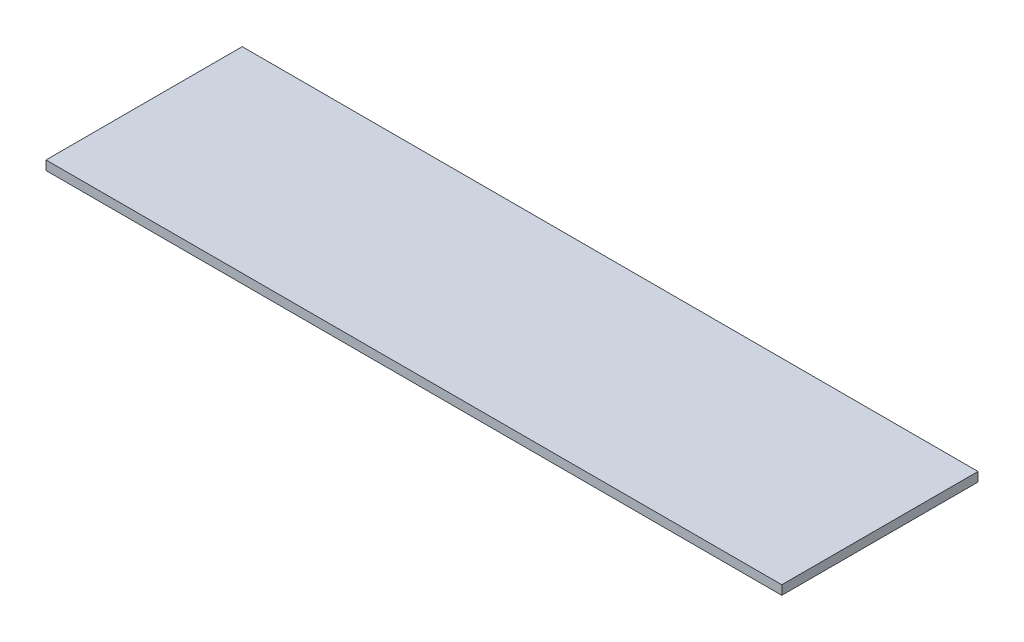
from build123d import *

# Parameters (mm, degrees)
SKETCH1_W           = 381
SKETCH1_H           = 101.6
BOSS_EXTRUDE1_DEPTH = 4.7625


with BuildPart() as part:
    # Sketch1 → Boss-Extrude1 (new body)
    with BuildSketch(Plane(origin=(0, 0, 0), x_dir=(1, 0, 0), z_dir=(0, 1, 0))):
        with Locations((190.5, 50.8)):
            Rectangle(SKETCH1_W, SKETCH1_H)
    extrude(amount=BOSS_EXTRUDE1_DEPTH)


solid = part.part
